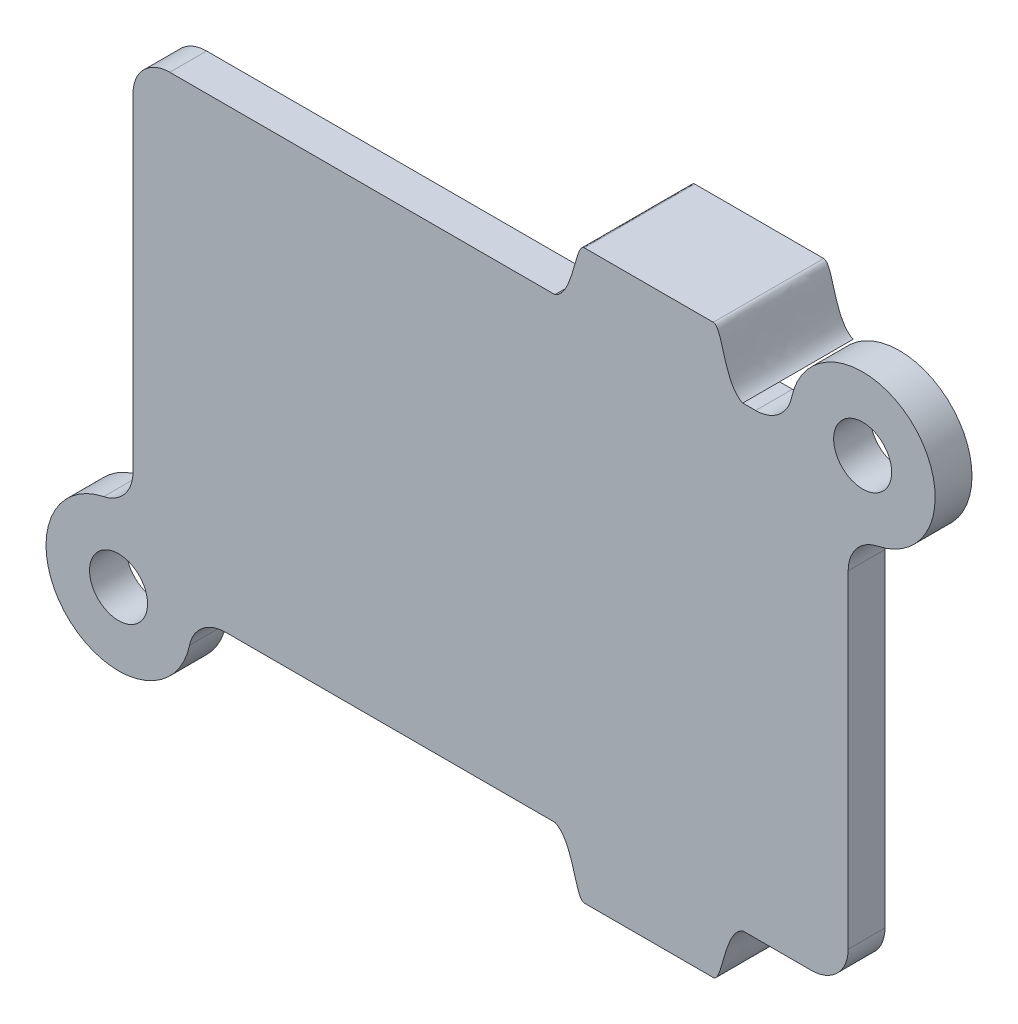
from build123d import *

# Parameters (mm, degrees)
SKETCH1_R           = 2
BOSS_EXTRUDE1_DEPTH = 2.54
SKETCH2_W           = 8.89
SKETCH2_H           = 3.81
BOSS_EXTRUDE2_DEPTH = 7.62


with BuildPart() as part:
    # Sketch1 → Boss-Extrude1 (new body)
    # profile 1 of 2: a face of its own
    with BuildSketch(Plane.XY):
        with BuildLine():
            ThreePointArc((42.939465347, 5.941095032), (41.487522441, 5.056745133), (40.918582885, 3.454708702))
            Line((40.918582885, 3.454708702), (40.918582885, 3.15450519))
            Line((40.918582885, 3.15450519), (40.918582885, -15.00649481))
            Line((40.918582885, -15.00649481), (40.918582885, -19.15304481))
            ThreePointArc((40.918582885, -19.15304481), (40.174634109, -20.949096034), (38.378582885, -21.69304481))
            Line((38.378582885, -21.69304481), (-2.034570627, -21.69304481))
            ThreePointArc((-2.034570627, -21.69304481), (-3.636607058, -22.261984366), (-4.520956957, -23.713927272))
            ThreePointArc((-4.520956957, -23.713927272), (-12.957358938, -26.229486634), (-10.441799577, -17.793084652))
            ThreePointArc((-10.441799577, -17.793084652), (-8.989856671, -16.908734753), (-8.420917115, -15.306698322))
            Line((-8.420917115, -15.306698322), (-8.420917115, -14.63819481))
            Line((-8.420917115, -14.63819481), (-8.420917115, 2.78620519))
            Line((-8.420917115, 2.78620519), (-8.420917115, 7.30105519))
            ThreePointArc((-8.420917115, 7.30105519), (-7.676968339, 9.097106414), (-5.880917115, 9.84105519))
            Line((-5.880917115, 9.84105519), (34.532236397, 9.84105519))
            ThreePointArc((34.532236397, 9.84105519), (36.134272828, 10.409994746), (37.018622727, 11.861937652))
            ThreePointArc((37.018622727, 11.861937652), (45.455024709, 14.377497013), (42.939465347, 5.941095032))
        make_face()
        with Locations((-9.419138026, -22.691265722)):
            Circle(SKETCH1_R, mode=Mode.SUBTRACT)
        with Locations((41.916803797, 10.839276102)):
            Circle(SKETCH1_R, mode=Mode.SUBTRACT)
        with BuildLine():
            ThreePointArc((38.378582885, 6.03105519), (38.006608497, 6.929080802), (37.108582885, 7.30105519))
            Line((37.108582885, 7.30105519), (-4.610917115, 7.30105519))
            ThreePointArc((-4.610917115, 7.30105519), (-5.508942727, 6.929080802), (-5.880917115, 6.03105519))
            Line((-5.880917115, 6.03105519), (-5.880917115, 2.78620519))
            Line((-5.880917115, 2.78620519), (-5.880917115, -14.63819481))
            Line((-5.880917115, -14.63819481), (-5.880917115, -17.88304481))
            ThreePointArc((-5.880917115, -17.88304481), (-5.508942727, -18.781070422), (-4.610917115, -19.15304481))
            Line((-4.610917115, -19.15304481), (37.108582885, -19.15304481))
            ThreePointArc((37.108582885, -19.15304481), (38.006608497, -18.781070422), (38.378582885, -17.88304481))
            Line((38.378582885, -17.88304481), (38.378582885, -15.00649481))
            Line((38.378582885, -15.00649481), (38.378582885, 3.15450519))
            Line((38.378582885, 3.15450519), (38.378582885, 6.03105519))
        make_face(mode=Mode.SUBTRACT)
    # profile 2 of 2: a face of its own
    with BuildSketch(Plane.XY):
        with BuildLine():
            Line((38.378582885, 6.03105519), (38.378582885, 3.15450519))
            Line((38.378582885, 3.15450519), (38.378582885, -15.00649481))
            Line((38.378582885, -15.00649481), (38.378582885, -17.88304481))
            ThreePointArc((38.378582885, -17.88304481), (38.006608497, -18.781070422), (37.108582885, -19.15304481))
            Line((37.108582885, -19.15304481), (-4.610917115, -19.15304481))
            ThreePointArc((-4.610917115, -19.15304481), (-5.508942727, -18.781070422), (-5.880917115, -17.88304481))
            Line((-5.880917115, -17.88304481), (-5.880917115, -14.63819481))
            Line((-5.880917115, -14.63819481), (-5.880917115, 2.78620519))
            Line((-5.880917115, 2.78620519), (-5.880917115, 6.03105519))
            ThreePointArc((-5.880917115, 6.03105519), (-5.508942727, 6.929080802), (-4.610917115, 7.30105519))
            Line((-4.610917115, 7.30105519), (37.108582885, 7.30105519))
            ThreePointArc((37.108582885, 7.30105519), (38.006608497, 6.929080802), (38.378582885, 6.03105519))
        make_face()
    extrude(amount=BOSS_EXTRUDE1_DEPTH)

    # Sketch2 → Boss-Extrude2 (add)
    with BuildSketch(Plane.XY.offset(2.54)):
        with BuildLine():
            Line((31.613029704, -21.69304481), (31.613029704, -25.50304481))
            add(Edge.make_bspline(
                [(31.613029704, -25.50304481), (32.285115867, -25.50304481), (32.316518426, -22.279360341), (33.645471093, -21.69304481)],
                knots=[0, 0, 0, 0, 1, 1, 1, 1], degree=3))
            Line((33.645471093, -21.69304481), (31.613029704, -21.69304481))
        make_face()
        with BuildLine():
            add(Edge.make_bspline(
                [(22.723029704, -25.50304481), (22.050943542, -25.50304481), (22.019540983, -22.279360341), (20.690588316, -21.69304481)],
                knots=[0, 0, 0, 0, 1, 1, 1, 1], degree=3))
            Line((22.723029704, -25.50304481), (22.723029704, -21.69304481))
            Line((22.723029704, -21.69304481), (20.690588316, -21.69304481))
        make_face()
        with Locations((27.168029704, -23.59804481)):
            Rectangle(SKETCH2_W, SKETCH2_H)
        with BuildLine():
            Line((20.690588316, 9.84105519), (22.723029704, 9.84105519))
            Line((22.723029704, 9.84105519), (22.723029704, 13.65105519))
            add(Edge.make_bspline(
                [(22.723029704, 13.65105519), (22.050943542, 13.65105519), (22.019540983, 10.427370721), (20.690588316, 9.84105519)],
                knots=[0, 0, 0, 0, 1, 1, 1, 1], degree=3))
        make_face()
        with Locations((27.168029704, 11.74605519)):
            Rectangle(SKETCH2_W, SKETCH2_H)
        with BuildLine():
            Line((31.613029704, 13.65105519), (31.613029704, 9.84105519))
            Line((31.613029704, 9.84105519), (33.645471093, 9.84105519))
            add(Edge.make_bspline(
                [(31.613029704, 13.65105519), (32.285115867, 13.65105519), (32.316518426, 10.427370721), (33.645471093, 9.84105519)],
                knots=[0, 0, 0, 0, 1, 1, 1, 1], degree=3))
        make_face()
    extrude(amount=-BOSS_EXTRUDE2_DEPTH)


solid = part.part
